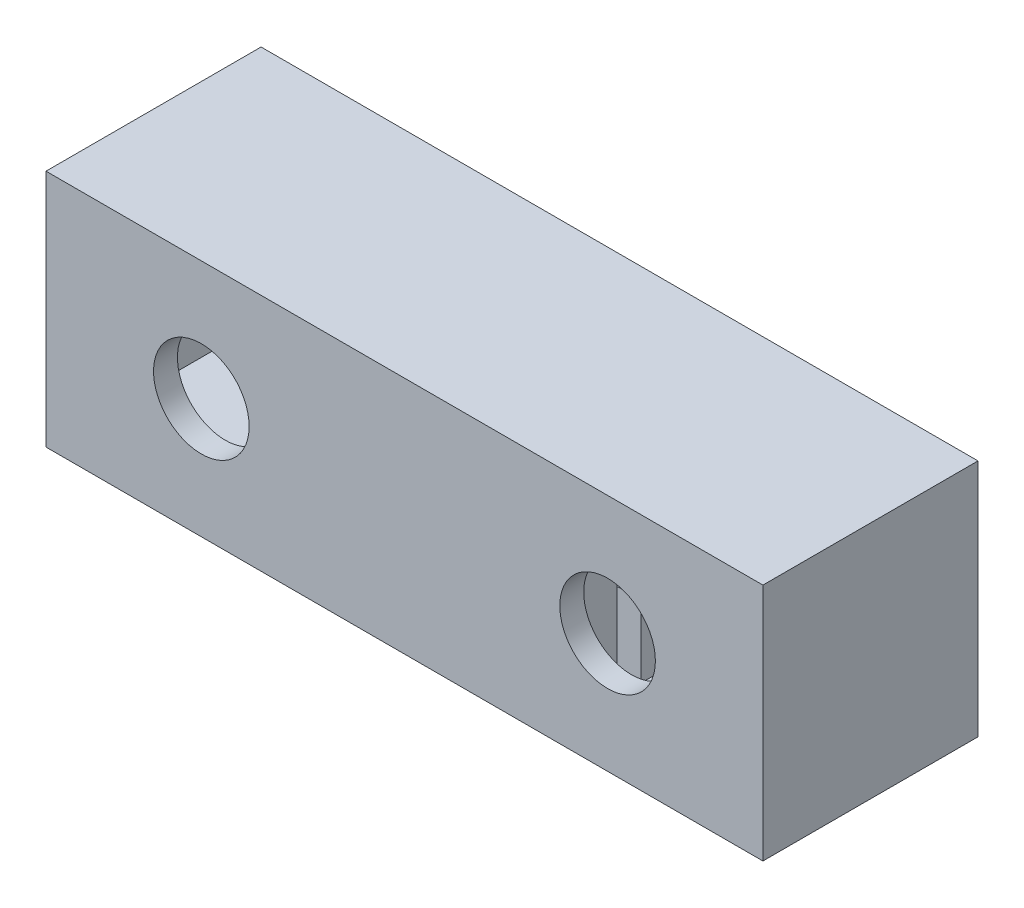
from build123d import *

# Parameters (mm, degrees)
SKETCH1_W           = 300
SKETCH1_H           = 100
SKETCH1_R           = 20
BOSS_EXTRUDE1_DEPTH = 10
SKETCH2_W           = 300
SKETCH2_H           = 100
SKETCH2_W_2         = 280
SKETCH2_H_2         = 80
BOSS_EXTRUDE2_DEPTH = 50
SKETCH3_W           = 120
SKETCH3_H           = 30
BOSS_EXTRUDE3_DEPTH = 50
SKETCH4_W           = 120
SKETCH4_H           = 20
BOSS_EXTRUDE4_DEPTH = 19
SKETCH7_W           = 31
SKETCH7_H           = 30
BOSS_EXTRUDE5_DEPTH = 10
SKETCH8_W           = 31
SKETCH8_H           = 30
BOSS_EXTRUDE6_DEPTH = 10
SKETCH9_W           = 300
SKETCH9_H           = 100
SKETCH9_W_2         = 280
SKETCH9_H_2         = 80
BOSS_EXTRUDE7_DEPTH = 30


with BuildPart() as part:
    # Sketch1 → Boss-Extrude1 (new body)
    with BuildSketch(Plane.XY):
        Rectangle(SKETCH1_W, SKETCH1_H)
        with Locations((-85, 0)):
            Circle(SKETCH1_R, mode=Mode.SUBTRACT)
        with Locations((85, 0)):
            Circle(SKETCH1_R, mode=Mode.SUBTRACT)
    extrude(amount=BOSS_EXTRUDE1_DEPTH)

    # Sketch2 → Boss-Extrude2 (add)
    with BuildSketch(Plane(origin=(0, 0, 0), x_dir=(-1, 0, 0), z_dir=(0, 0, -1))):
        Rectangle(SKETCH2_W, SKETCH2_H)
        Rectangle(SKETCH2_W_2, SKETCH2_H_2, mode=Mode.SUBTRACT)
    extrude(amount=BOSS_EXTRUDE2_DEPTH)

    # Sketch3 → Boss-Extrude3 (add)
    with BuildSketch(Plane(origin=(0, 0, 0), x_dir=(-1, 0, 0), z_dir=(0, 0, -1))):
        with Locations((0, 25)):
            Rectangle(SKETCH3_W, SKETCH3_H)
        with Locations((0, -25)):
            Rectangle(SKETCH3_W, SKETCH3_H)
    extrude(amount=BOSS_EXTRUDE3_DEPTH)

    # Sketch4 → Boss-Extrude4 (add)
    with BuildSketch(Plane(origin=(0, 0, 0), x_dir=(-1, 0, 0), z_dir=(0, 0, -1))):
        Rectangle(SKETCH4_W, SKETCH4_H)
    extrude(amount=BOSS_EXTRUDE4_DEPTH)

    # Sketch7 → Boss-Extrude5 (add)
    with BuildSketch(Plane(origin=(60, 0, 0), x_dir=(0, 0, -1), z_dir=(1, 0, 0))):
        with Locations((34.5, 25)):
            Rectangle(SKETCH7_W, SKETCH7_H)
        with Locations((34.5, -25)):
            Rectangle(SKETCH7_W, SKETCH7_H)
    extrude(amount=BOSS_EXTRUDE5_DEPTH)

    # Sketch8 → Boss-Extrude6 (add)
    with BuildSketch(Plane.ZY.offset(60)):
        with Locations((-34.5, 25)):
            Rectangle(SKETCH8_W, SKETCH8_H)
        with Locations((-34.5, -25)):
            Rectangle(SKETCH8_W, SKETCH8_H)
    extrude(amount=BOSS_EXTRUDE6_DEPTH)

    # Sketch9 → Boss-Extrude7 (add)
    with BuildSketch(Plane(origin=(0, 0, -50), x_dir=(-1, 0, 0), z_dir=(0, 0, -1))):
        Rectangle(SKETCH9_W, SKETCH9_H)
        Rectangle(SKETCH9_W_2, SKETCH9_H_2, mode=Mode.SUBTRACT)
    extrude(amount=BOSS_EXTRUDE7_DEPTH)


solid = part.part
